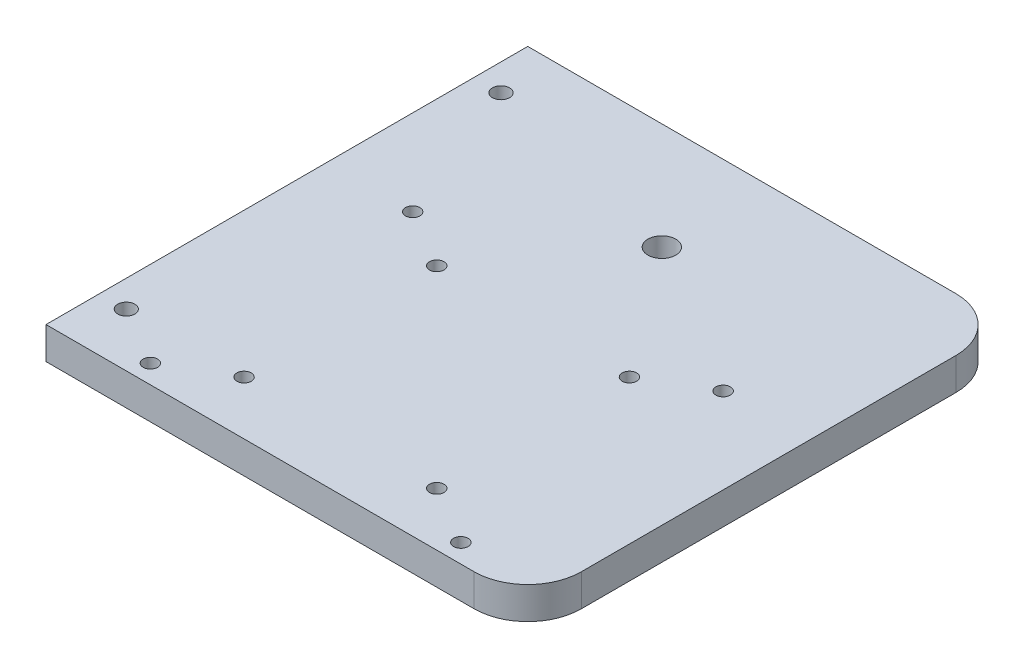
from build123d import *

# Parameters (mm, degrees)
SKETCH_1_W          = 90
SKETCH_1_H          = 90
EXTRUDE_1_DEPTH     = 6
SKETCH_2_R          = 1.35
CUT_EXTRUDE_1_DEPTH = 6
SKETCH_3_R          = 2.6
CUT_EXTRUDE_2_DEPTH = 6
SKETCH_4_R          = 1.6
CUT_EXTRUDE_3_DEPTH = 6
FILLET_1_R          = 10


with BuildPart() as part:
    # 草图1 → 凸台-拉伸1 (new body)
    with BuildSketch(Plane(origin=(0, 0, 0), x_dir=(1, 0, 0), z_dir=(0, 1, 0))):
        Rectangle(SKETCH_1_W, SKETCH_1_H)
    extrude(amount=EXTRUDE_1_DEPTH)

    # 草图2 → 切除-拉伸1 (cut)
    with BuildSketch(Plane(origin=(0, 6, 0), x_dir=(1, 0, 0), z_dir=(0, 1, 0))):
        with Locations(Location((-29, 7.5, 0), (0, 0, 270))):
            Circle(SKETCH_2_R)
        with Locations(Location((-29, -41.5, 0), (0, 0, 270))):
            Circle(SKETCH_2_R)
        with Locations(Location((-18, 1, 0), (0, 0, 270))):
            Circle(SKETCH_2_R)
        with Locations(Location((-18, -35, 0), (0, 0, 270))):
            Circle(SKETCH_2_R)
        with Locations(Location((18, -35, 0), (0, 0, 270))):
            Circle(SKETCH_2_R)
        with Locations(Location((29, -41.5, 0), (0, 0, 270))):
            Circle(SKETCH_2_R)
        with Locations(Location((18, 1, 0), (0, 0, 270))):
            Circle(SKETCH_2_R)
        with Locations(Location((29, 7.5, 0), (0, 0, 270))):
            Circle(SKETCH_2_R)
    extrude(amount=-CUT_EXTRUDE_1_DEPTH, mode=Mode.SUBTRACT)

    # 草图3 → 切除-拉伸2 (cut)
    with BuildSketch(Plane(origin=(0, 6, 0), x_dir=(1, 0, 0), z_dir=(0, 1, 0))):
        with Locations(Location((0, 25.05, 0), (0, 0, 270))):
            Circle(SKETCH_3_R)
    extrude(amount=-CUT_EXTRUDE_2_DEPTH, mode=Mode.SUBTRACT)

    # 草图4 → 切除-拉伸3 (cut)
    with BuildSketch(Plane(origin=(0, 6, 0), x_dir=(1, 0, 0), z_dir=(0, 1, 0))):
        with Locations(Location((-40, -35, 0), (0, 0, 270))):
            Circle(SKETCH_4_R)
        with Locations(Location((-40, 35, 0), (0, 0, 90))):
            Circle(SKETCH_4_R)
    extrude(amount=-CUT_EXTRUDE_3_DEPTH, mode=Mode.SUBTRACT)

    # 圆角1
    fillet_1_edges = [part.edges().sort_by_distance(p)[0] for p in [
        (45, 3, 45),
        (45, 3, -45),
    ]]
    fillet(fillet_1_edges, radius=FILLET_1_R)


solid = part.part
